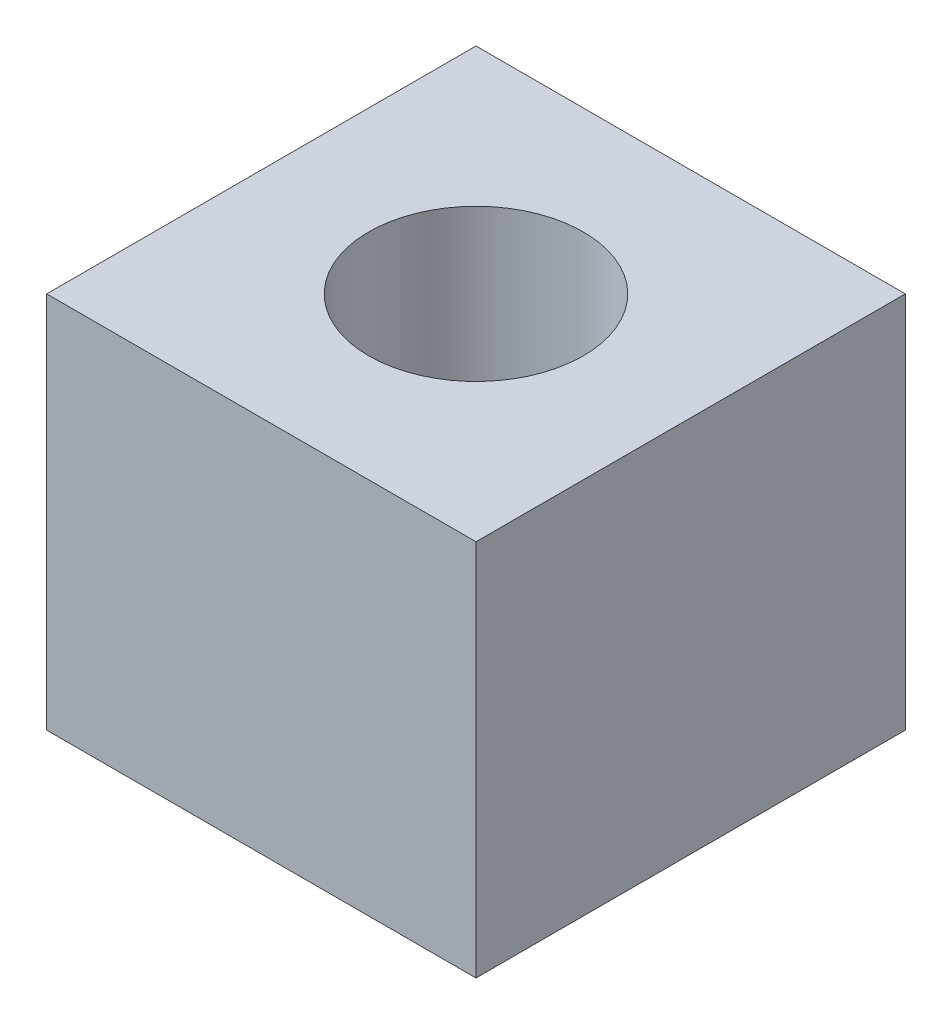
from build123d import *

# Parameters (mm, degrees)
SKETCH1_W           = 25.4
SKETCH1_H           = 25.4
BOSS_EXTRUDE1_DEPTH = 22.352
SKETCH2_R           = 6.35
CUT_EXTRUDE1_DEPTH  = 25.4


with BuildPart() as part:
    # Sketch1 → Boss-Extrude1 (new body)
    with BuildSketch(Plane(origin=(0, 0, 0), x_dir=(1, 0, 0), z_dir=(0, 1, 0))):
        Rectangle(SKETCH1_W, SKETCH1_H)
    extrude(amount=BOSS_EXTRUDE1_DEPTH)

    # Sketch2 → Cut-Extrude1 (cut)
    with BuildSketch(Plane(origin=(0, 22.352, 0), x_dir=(1, 0, 0), z_dir=(0, 1, 0))):
        with Locations(Location((0, 0, 0), (0, 0, 270))):
            Circle(SKETCH2_R)
    extrude(amount=-CUT_EXTRUDE1_DEPTH, mode=Mode.SUBTRACT)


solid = part.part
